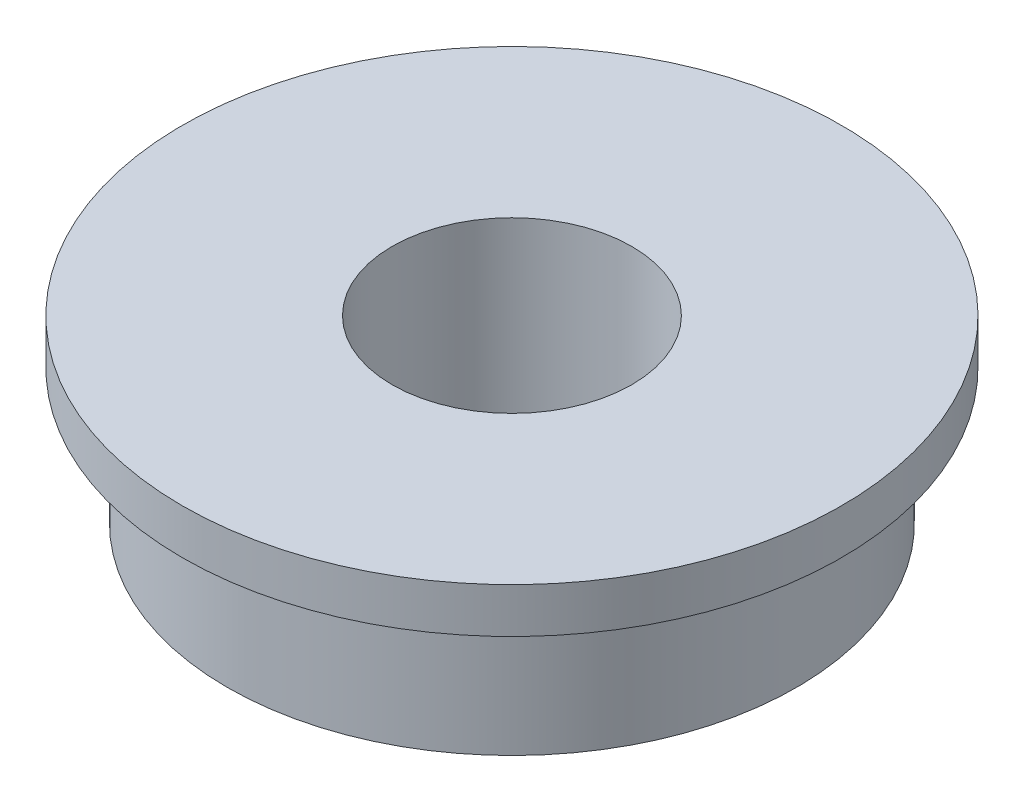
from build123d import *

# Parameters (mm, degrees)
SKETCH_1_R          = 9.5
EXTRUDE_1_DEPTH     = 4.5
SKETCH_2_R          = 11
EXTRUDE_2_DEPTH     = 1.5
SKETCH_3_R          = 4
CUT_EXTRUDE_1_DEPTH = 17.673332001


with BuildPart() as part:
    # 草图1 → 凸台-拉伸1 (new body)
    with BuildSketch(Plane(origin=(0, 0, 0), x_dir=(1, 0, 0), z_dir=(0, 1, 0))):
        with Locations(Location((0, 0, 0), (0, 0, 270))):
            Circle(SKETCH_1_R)
    extrude(amount=EXTRUDE_1_DEPTH)

    # 草图2 → 凸台-拉伸2 (add)
    with BuildSketch(Plane(origin=(0, 4.5, 0), x_dir=(1, 0, 0), z_dir=(0, 1, 0))):
        with Locations(Location((0, 0, 0), (0, 0, 270))):
            Circle(SKETCH_2_R)
    extrude(amount=EXTRUDE_2_DEPTH)

    # 草图3 → 切除-拉伸1 (cut, through all)
    with BuildSketch(Plane(origin=(0, 6, 0), x_dir=(1, 0, 0), z_dir=(0, 1, 0))):
        with Locations(Location((0, 0, 0), (0, 0, 270))):
            Circle(SKETCH_3_R)
    extrude(amount=-CUT_EXTRUDE_1_DEPTH, mode=Mode.SUBTRACT)


solid = part.part
